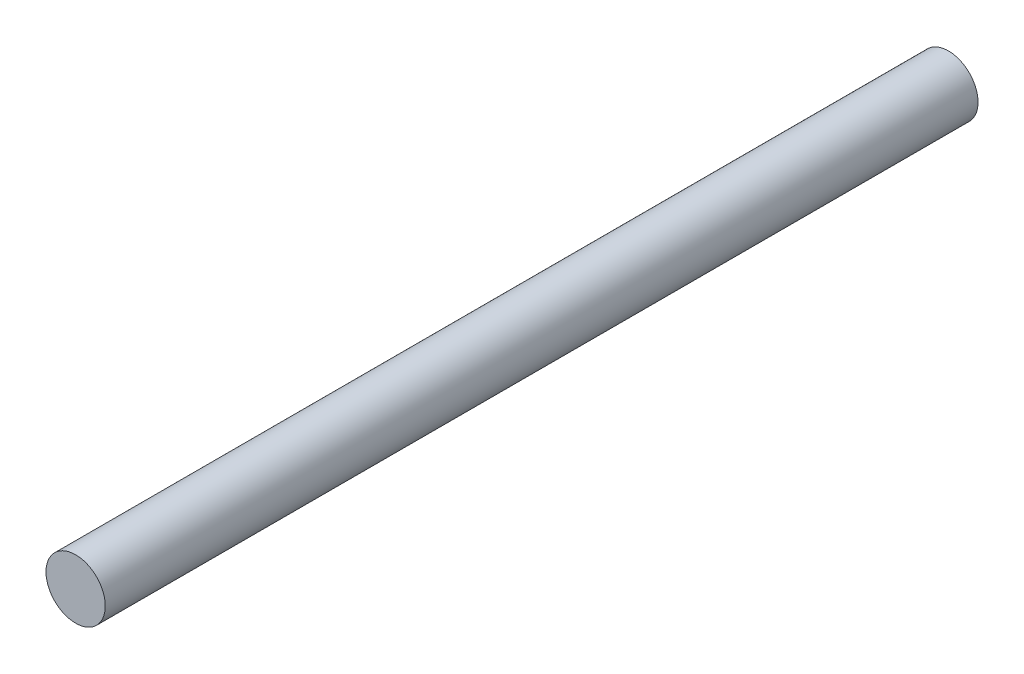
from build123d import *

# Parameters (mm, degrees)
SKETCH1_R      = 3.96875
EXTRUDE1_DEPTH = 58.42


with BuildPart() as part:
    # Sketch1 → Extrude1 (new, symmetric)
    with BuildSketch(Plane.XY):
        with Locations(Location((0, 0, 0), (0, 0, 180))):
            Circle(SKETCH1_R)
    extrude(amount=EXTRUDE1_DEPTH, both=True)


solid = part.part
